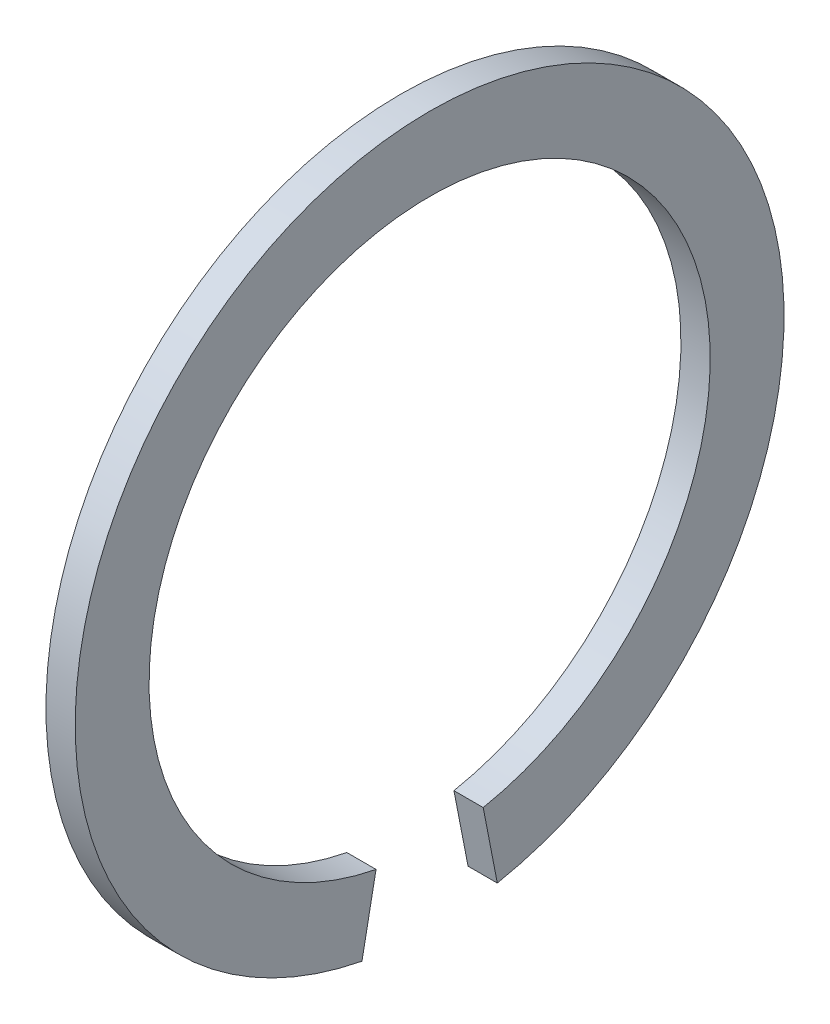
from build123d import *

# Parameters (mm, degrees)
BOSS_EXTRUDE1_DEPTH = 1.09


with BuildPart() as part:
    # Sketch1 → Boss-Extrude1 (new body)
    with BuildSketch(Plane(origin=(0, 0, 0), x_dir=(0, 0, -1), z_dir=(1, 0, 0))):
        with BuildLine():
            Line((-1.995374515, -10.257727845), (-2.520473071, -12.95712991))
            ThreePointArc((-2.520473071, -12.95712991), (0, 13.2), (2.520473071, -12.95712991))
            Line((2.520473071, -12.95712991), (1.995374515, -10.257727845))
            ThreePointArc((1.995374515, -10.257727845), (0, 10.45), (-1.995374515, -10.257727845))
        make_face()
    extrude(amount=BOSS_EXTRUDE1_DEPTH)


solid = part.part
